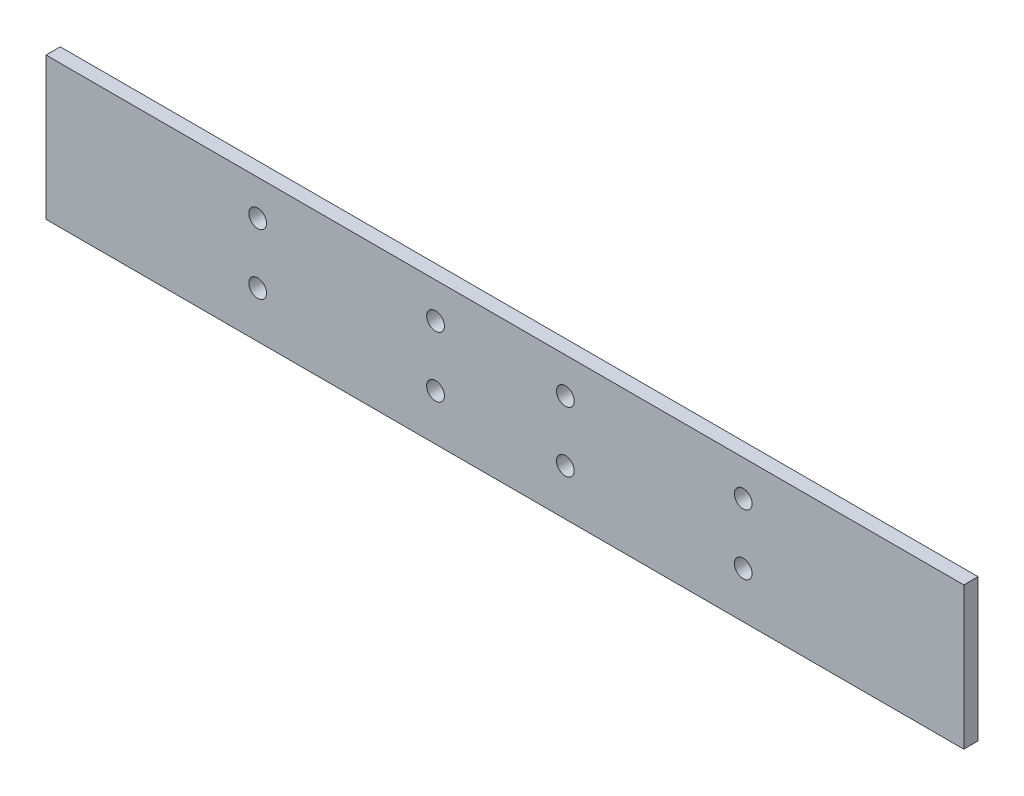
from build123d import *

# Parameters (mm, degrees)
SKETCH1_W           = 258
SKETCH1_H           = 40
SKETCH1_R           = 2.5
BOSS_EXTRUDE1_DEPTH = 4


with BuildPart() as part:
    # Sketch1 → Boss-Extrude1 (new body)
    with BuildSketch(Plane.XY):
        Rectangle(SKETCH1_W, SKETCH1_H)
        with Locations((-69.5, 10)):
            Circle(SKETCH1_R, mode=Mode.SUBTRACT)
        with Locations((-19.5, 10)):
            Circle(SKETCH1_R, mode=Mode.SUBTRACT)
        with Locations(Location((17, 10, 0), (0, 0, 180))):
            Circle(SKETCH1_R, mode=Mode.SUBTRACT)
        with Locations(Location((67, 10, 0), (0, 0, 180))):
            Circle(SKETCH1_R, mode=Mode.SUBTRACT)
        with Locations((-69.5, -7)):
            Circle(SKETCH1_R, mode=Mode.SUBTRACT)
        with Locations((-19.5, -7)):
            Circle(SKETCH1_R, mode=Mode.SUBTRACT)
        with Locations(Location((17, -7, 0), (0, 0, 180))):
            Circle(SKETCH1_R, mode=Mode.SUBTRACT)
        with Locations(Location((67, -7, 0), (0, 0, 180))):
            Circle(SKETCH1_R, mode=Mode.SUBTRACT)
    extrude(amount=BOSS_EXTRUDE1_DEPTH)


solid = part.part
